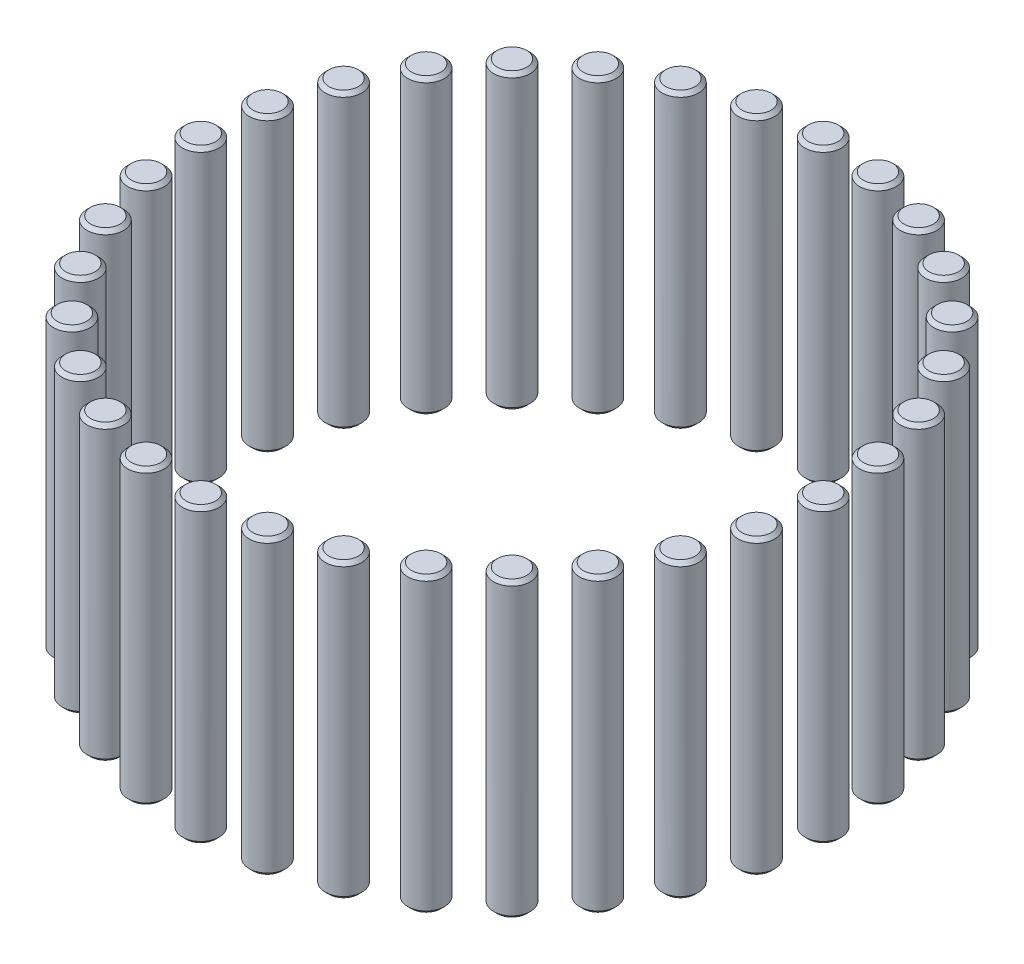
from build123d import *

# Parameters (mm, degrees)
SKETCH1_W         = 0.5
SKETCH1_H         = 8
CHAMFER1_SIZE     = 0.1
CIRPATTERN1_COUNT = 32


with BuildPart() as part:
    # Sketch1 → Revolve1 (revolve)
    with BuildSketch(Plane.XY, mode=Mode.PRIVATE) as revolve1_sk:
        with Locations((0.25, 4)):
            Rectangle(SKETCH1_W, SKETCH1_H)
    revolve(revolve1_sk.sketch.rotate(Axis((0, 8, 0), (0, -1, 0)), 180), axis=Axis((0, 8, 0), (0, -1, 0)))

    # Chamfer1
    chamfer1_edges = [part.edges().sort_by_distance(p)[0] for p in [
        (0.5, 0, 0),
        (0.5, 8, 0),
    ]]
    chamfer(chamfer1_edges, length=CHAMFER1_SIZE)


with BuildPart() as cirpattern1_1:
    # CirPattern1: pattern copy
    add(part.part.rotate(Axis((0, 0, 8.5), (0, 1, 0)), 1 * 360 / CIRPATTERN1_COUNT))


with BuildPart() as cirpattern1_2:
    # CirPattern1: pattern copy
    add(part.part.rotate(Axis((0, 0, 8.5), (0, 1, 0)), 2 * 360 / CIRPATTERN1_COUNT))


with BuildPart() as cirpattern1_3:
    # CirPattern1: pattern copy
    add(part.part.rotate(Axis((0, 0, 8.5), (0, 1, 0)), 3 * 360 / CIRPATTERN1_COUNT))


with BuildPart() as cirpattern1_4:
    # CirPattern1: pattern copy
    add(part.part.rotate(Axis((0, 0, 8.5), (0, 1, 0)), 4 * 360 / CIRPATTERN1_COUNT))


with BuildPart() as cirpattern1_5:
    # CirPattern1: pattern copy
    add(part.part.rotate(Axis((0, 0, 8.5), (0, 1, 0)), 5 * 360 / CIRPATTERN1_COUNT))


with BuildPart() as cirpattern1_6:
    # CirPattern1: pattern copy
    add(part.part.rotate(Axis((0, 0, 8.5), (0, 1, 0)), 6 * 360 / CIRPATTERN1_COUNT))


with BuildPart() as cirpattern1_7:
    # CirPattern1: pattern copy
    add(part.part.rotate(Axis((0, 0, 8.5), (0, 1, 0)), 7 * 360 / CIRPATTERN1_COUNT))


with BuildPart() as cirpattern1_8:
    # CirPattern1: pattern copy
    add(part.part.rotate(Axis((0, 0, 8.5), (0, 1, 0)), 8 * 360 / CIRPATTERN1_COUNT))


with BuildPart() as cirpattern1_9:
    # CirPattern1: pattern copy
    add(part.part.rotate(Axis((0, 0, 8.5), (0, 1, 0)), 9 * 360 / CIRPATTERN1_COUNT))


with BuildPart() as cirpattern1_10:
    # CirPattern1: pattern copy
    add(part.part.rotate(Axis((0, 0, 8.5), (0, 1, 0)), 10 * 360 / CIRPATTERN1_COUNT))


with BuildPart() as cirpattern1_11:
    # CirPattern1: pattern copy
    add(part.part.rotate(Axis((0, 0, 8.5), (0, 1, 0)), 11 * 360 / CIRPATTERN1_COUNT))


with BuildPart() as cirpattern1_12:
    # CirPattern1: pattern copy
    add(part.part.rotate(Axis((0, 0, 8.5), (0, 1, 0)), 12 * 360 / CIRPATTERN1_COUNT))


with BuildPart() as cirpattern1_13:
    # CirPattern1: pattern copy
    add(part.part.rotate(Axis((0, 0, 8.5), (0, 1, 0)), 13 * 360 / CIRPATTERN1_COUNT))


with BuildPart() as cirpattern1_14:
    # CirPattern1: pattern copy
    add(part.part.rotate(Axis((0, 0, 8.5), (0, 1, 0)), 14 * 360 / CIRPATTERN1_COUNT))


with BuildPart() as cirpattern1_15:
    # CirPattern1: pattern copy
    add(part.part.rotate(Axis((0, 0, 8.5), (0, 1, 0)), 15 * 360 / CIRPATTERN1_COUNT))


with BuildPart() as cirpattern1_16:
    # CirPattern1: pattern copy
    add(part.part.rotate(Axis((0, 0, 8.5), (0, 1, 0)), 16 * 360 / CIRPATTERN1_COUNT))


with BuildPart() as cirpattern1_17:
    # CirPattern1: pattern copy
    add(part.part.rotate(Axis((0, 0, 8.5), (0, 1, 0)), 17 * 360 / CIRPATTERN1_COUNT))


with BuildPart() as cirpattern1_18:
    # CirPattern1: pattern copy
    add(part.part.rotate(Axis((0, 0, 8.5), (0, 1, 0)), 18 * 360 / CIRPATTERN1_COUNT))


with BuildPart() as cirpattern1_19:
    # CirPattern1: pattern copy
    add(part.part.rotate(Axis((0, 0, 8.5), (0, 1, 0)), 19 * 360 / CIRPATTERN1_COUNT))


with BuildPart() as cirpattern1_20:
    # CirPattern1: pattern copy
    add(part.part.rotate(Axis((0, 0, 8.5), (0, 1, 0)), 20 * 360 / CIRPATTERN1_COUNT))


with BuildPart() as cirpattern1_21:
    # CirPattern1: pattern copy
    add(part.part.rotate(Axis((0, 0, 8.5), (0, 1, 0)), 21 * 360 / CIRPATTERN1_COUNT))


with BuildPart() as cirpattern1_22:
    # CirPattern1: pattern copy
    add(part.part.rotate(Axis((0, 0, 8.5), (0, 1, 0)), 22 * 360 / CIRPATTERN1_COUNT))


with BuildPart() as cirpattern1_23:
    # CirPattern1: pattern copy
    add(part.part.rotate(Axis((0, 0, 8.5), (0, 1, 0)), 23 * 360 / CIRPATTERN1_COUNT))


with BuildPart() as cirpattern1_24:
    # CirPattern1: pattern copy
    add(part.part.rotate(Axis((0, 0, 8.5), (0, 1, 0)), 24 * 360 / CIRPATTERN1_COUNT))


with BuildPart() as cirpattern1_25:
    # CirPattern1: pattern copy
    add(part.part.rotate(Axis((0, 0, 8.5), (0, 1, 0)), 25 * 360 / CIRPATTERN1_COUNT))


with BuildPart() as cirpattern1_26:
    # CirPattern1: pattern copy
    add(part.part.rotate(Axis((0, 0, 8.5), (0, 1, 0)), 26 * 360 / CIRPATTERN1_COUNT))


with BuildPart() as cirpattern1_27:
    # CirPattern1: pattern copy
    add(part.part.rotate(Axis((0, 0, 8.5), (0, 1, 0)), 27 * 360 / CIRPATTERN1_COUNT))


with BuildPart() as cirpattern1_28:
    # CirPattern1: pattern copy
    add(part.part.rotate(Axis((0, 0, 8.5), (0, 1, 0)), 28 * 360 / CIRPATTERN1_COUNT))


with BuildPart() as cirpattern1_29:
    # CirPattern1: pattern copy
    add(part.part.rotate(Axis((0, 0, 8.5), (0, 1, 0)), 29 * 360 / CIRPATTERN1_COUNT))


with BuildPart() as cirpattern1_30:
    # CirPattern1: pattern copy
    add(part.part.rotate(Axis((0, 0, 8.5), (0, 1, 0)), 30 * 360 / CIRPATTERN1_COUNT))


with BuildPart() as cirpattern1_31:
    # CirPattern1: pattern copy
    add(part.part.rotate(Axis((0, 0, 8.5), (0, 1, 0)), 31 * 360 / CIRPATTERN1_COUNT))


solid = Compound([part.part, cirpattern1_1.part, cirpattern1_2.part, cirpattern1_3.part, cirpattern1_4.part, cirpattern1_5.part, cirpattern1_6.part, cirpattern1_7.part, cirpattern1_8.part, cirpattern1_9.part, cirpattern1_10.part, cirpattern1_11.part, cirpattern1_12.part, cirpattern1_13.part, cirpattern1_14.part, cirpattern1_15.part, cirpattern1_16.part, cirpattern1_17.part, cirpattern1_18.part, cirpattern1_19.part, cirpattern1_20.part, cirpattern1_21.part, cirpattern1_22.part, cirpattern1_23.part, cirpattern1_24.part, cirpattern1_25.part, cirpattern1_26.part, cirpattern1_27.part, cirpattern1_28.part, cirpattern1_29.part, cirpattern1_30.part, cirpattern1_31.part])
